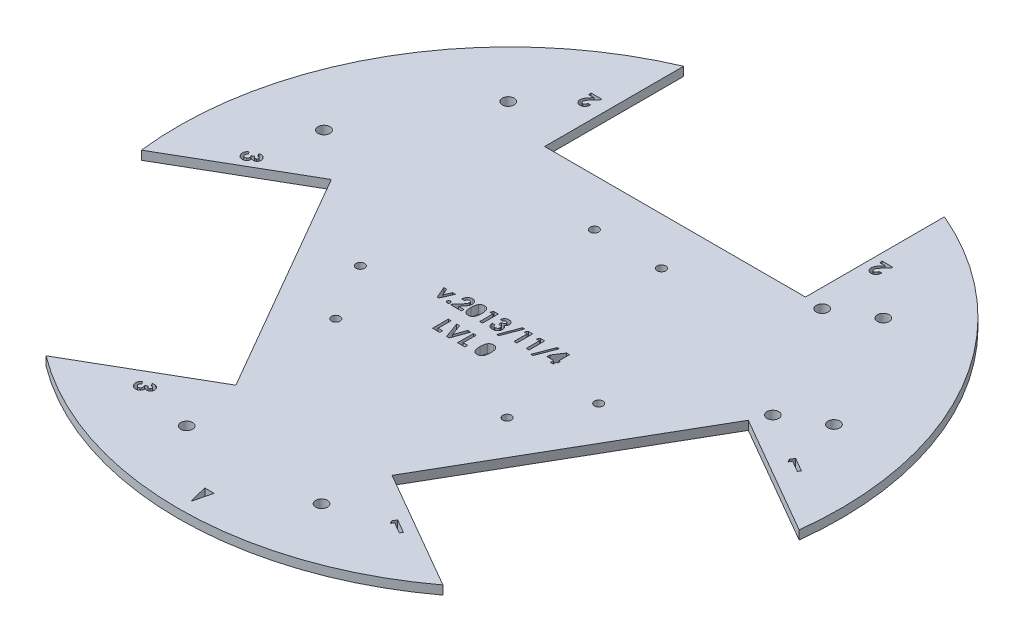
from build123d import *

# Parameters (mm, degrees)
ACRILIC_WHEELS_AND_MOTOR_MOUNTING_HOLES_DEPTH = 2.3622
STRUCTURE_MOUNTING_HOLES_DEPTH                = 2.3622
SKETCH4_R                                     = 1.15
SKETCH4_R_2                                   = 1.59
CUT_EXTRUDE1_DEPTH                            = 10


with BuildPart() as part:
    # Sketch1 → Acrilic, Wheels and Motor mounting holes (new body)
    with BuildSketch(Plane(origin=(0, 0, 0), x_dir=(1, 0, 0), z_dir=(0, 1, 0))):
        with BuildLine():
            Line((-35, 44.411902139), (-35, 81.720315712))
            ThreePointArc((-35, 81.720315712), (-76.989658396, 44.45), (-88.271869412, -10.549268723))
            Line((-88.271869412, -10.549268723), (-55.961835482, 8.104938063))
            Line((-55.961835482, 8.104938063), (-20.961835482, -52.516840202))
            Line((-20.961835482, -52.516840202), (-53.271869412, -71.171046988))
            ThreePointArc((-53.271869412, -71.171046988), (0, -88.9), (53.271869412, -71.171046988))
            Line((53.271869412, -71.171046988), (20.961835482, -52.516840202))
            Line((20.961835482, -52.516840202), (55.961835482, 8.104938063))
            Line((55.961835482, 8.104938063), (88.271869412, -10.549268723))
            ThreePointArc((88.271869412, -10.549268723), (76.989658396, 44.45), (35, 81.720315712))
            Line((35, 81.720315712), (35, 44.411902139))
            Line((35, 44.411902139), (-35, 44.411902139))
        make_face()
    extrude(amount=ACRILIC_WHEELS_AND_MOTOR_MOUNTING_HOLES_DEPTH)

    # Sketch3 → Structure Mounting Holes (cut)
    # profile 1 of 22: a face of its own
    with BuildSketch(Plane(origin=(0, 2.3622, 0), x_dir=(1, 0, 0), z_dir=(0, 1, 0))):
        Polygon((-1.25, -80.58), (0, -85.58), (1.25, -80.58), align=None)
    # profile 2 of 22: a face of its own
    with BuildSketch(Plane(origin=(0, 2.3622, 0), x_dir=(1, 0, 0), z_dir=(0, 1, 0))):
        with BuildLine():
            Line((-39.233333333, 60.243886703), (-38.473504273, 60.243886703))
            add(Edge.make_bspline(
                [(-38.473504273, 60.243886703), (-38.47678457, 60.186409053), (-38.483194073, 60.074101176), (-38.50871742, 59.910980475), (-38.542829951, 59.756811636), (-38.58874626, 59.612058152), (-38.645302495, 59.476659208), (-38.713906276, 59.351063304), (-38.792509338, 59.234370487), (-38.882696074, 59.128627316), (-38.980806241, 59.033560991), (-39.086588317, 58.950451513), (-39.199741814, 58.880878011), (-39.319510101, 58.823806551), (-39.445422742, 58.778142031), (-39.578751905, 58.747627678), (-39.718321136, 58.726958588), (-39.813868424, 58.725150252), (-39.862566773, 58.724228583)],
                knots=[0, 0, 0, 0, 1.198928049, 2.342633425, 3.435730849, 4.486331048, 5.502589352, 6.488331875, 7.46361919, 8.428949135, 9.378681775, 10.305958057, 11.226249248, 12.140413166, 13.066341608, 14.010670971, 14.986082777, 16, 16, 16, 16], degree=3))
            add(Edge.make_bspline(
                [(-39.862566773, 58.724228583), (-39.922368833, 58.725971441), (-40.039167765, 58.729375404), (-40.208343885, 58.762149283), (-40.367348991, 58.812633912), (-40.514611801, 58.885245216), (-40.649360484, 58.977226335), (-40.769993167, 59.088075412), (-40.877063493, 59.216432734), (-40.967041726, 59.361360135), (-41.04022663, 59.515358409), (-41.093067797, 59.673667626), (-41.127388997, 59.833095836), (-41.131074891, 59.940408563), (-41.132905983, 59.993719769)],
                knots=[0, 0, 0, 0, 1.075206757, 2.099977874, 3.089436832, 4.070080219, 5.043757236, 6.01602434, 7.009399377, 8.042659726, 9.078134622, 10.07077983, 11.041594984, 12, 12, 12, 12], degree=3))
            add(Edge.make_bspline(
                [(-41.132905983, 59.993719769), (-41.132195753, 60.025968023), (-41.130766235, 60.090875792), (-41.120826609, 60.189097176), (-41.105915208, 60.289147141), (-41.083432442, 60.390939897), (-41.055394616, 60.494504001), (-41.021380573, 60.600149295), (-40.980601839, 60.70727716), (-40.933736911, 60.817091918), (-40.877833688, 60.929955645), (-40.812714374, 61.047537313), (-40.736582123, 61.170160469), (-40.65018021, 61.297443343), (-40.554117271, 61.430373043), (-40.446931123, 61.567375224), (-40.329994564, 61.709996627), (-40.246974056, 61.805312489), (-40.204320246, 61.854283338)],
                knots=[0, 0, 0, 0, 0.728286467, 1.465860763, 2.227952348, 3.011875114, 3.818782069, 4.650637576, 5.517456182, 6.406927181, 7.346324104, 8.360844784, 9.441645378, 10.605053135, 11.834886952, 13.145197974, 14.533275831, 16, 16, 16, 16], degree=3))
            Line((-40.204320246, 61.854283338), (-39.7625, 62.36055337))
            Line((-39.7625, 62.36055337), (-41.187179487, 62.36055337))
            Line((-41.187179487, 62.36055337), (-41.187179487, 63.066108925))
            Line((-41.187179487, 63.066108925), (-38.364957265, 63.066108925))
            Line((-38.364957265, 63.066108925), (-38.364957265, 62.681106254))
            Line((-38.364957265, 62.681106254), (-39.618336004, 61.347165282))
            add(Edge.make_bspline(
                [(-39.618336004, 61.347165282), (-39.654625114, 61.308254197), (-39.724906359, 61.232894964), (-39.824899994, 61.12221559), (-39.915418702, 61.017206178), (-39.994438497, 60.916648965), (-40.066740303, 60.823948688), (-40.127226081, 60.735600922), (-40.179901784, 60.654093695), (-40.234927119, 60.554739629), (-40.288385689, 60.437137204), (-40.337406345, 60.301738125), (-40.366988295, 60.172237042), (-40.371102977, 60.087700276), (-40.373076923, 60.04714525)],
                knots=[0, 0, 0, 0, 1.246192343, 2.413505005, 3.49357156, 4.492416076, 5.408771964, 6.246246772, 6.999304986, 7.680960093, 8.904522682, 10.020616941, 11.0504258, 12, 12, 12, 12], degree=3))
            add(Edge.make_bspline(
                [(-40.373076923, 60.04714525), (-40.371627931, 60.007898316), (-40.368820277, 59.931851089), (-40.337197363, 59.823989032), (-40.289881669, 59.725589857), (-40.221188254, 59.641135917), (-40.138277057, 59.571131455), (-40.041920469, 59.519833031), (-39.933887672, 59.489682515), (-39.858235549, 59.485968339), (-39.819317575, 59.484057643)],
                knots=[0, 0, 0, 0, 1.061596218, 2.057012874, 3.024113775, 4.006148568, 4.986025304, 5.949989669, 6.945406325, 8, 8, 8, 8], degree=3))
            add(Edge.make_bspline(
                [(-39.819317575, 59.484057643), (-39.799216018, 59.484768625), (-39.759642877, 59.486168307), (-39.701473451, 59.495485614), (-39.646121064, 59.511906395), (-39.592969612, 59.533907929), (-39.542586341, 59.563071121), (-39.495098334, 59.599019401), (-39.450005245, 59.640839243), (-39.407513889, 59.68839988), (-39.368841207, 59.741477565), (-39.334492273, 59.799587542), (-39.306091423, 59.86269374), (-39.281086282, 59.929963061), (-39.261801121, 60.002118032), (-39.247759131, 60.078726814), (-39.237083944, 60.159664775), (-39.23460628, 60.215302012), (-39.233333333, 60.243886703)],
                knots=[0, 0, 0, 0, 0.903469896, 1.778625579, 2.63899355, 3.493148037, 4.358286772, 5.247621495, 6.164656832, 7.118446693, 8.109501108, 9.111810964, 10.146451449, 11.215617525, 12.33435995, 13.498009769, 14.714554818, 16, 16, 16, 16], degree=3))
        make_face()
    # profile 3 of 22: a face of its own
    with BuildSketch(Plane(origin=(0, 2.3622, 0), x_dir=(1, 0, 0), z_dir=(0, 1, 0))):
        with BuildLine():
            Line((38.907692308, 60.243886703), (39.667521368, 60.243886703))
            add(Edge.make_bspline(
                [(39.667521368, 60.243886703), (39.664241071, 60.186409053), (39.657831568, 60.074101176), (39.632308221, 59.910980475), (39.59819569, 59.756811636), (39.552279381, 59.612058152), (39.495723146, 59.476659208), (39.427119365, 59.351063304), (39.348516303, 59.234370487), (39.258329567, 59.128627316), (39.1602194, 59.033560991), (39.054437324, 58.950451513), (38.941283827, 58.880878011), (38.82151554, 58.823806551), (38.695602899, 58.778142031), (38.562273736, 58.747627678), (38.422704505, 58.726958588), (38.327157217, 58.725150252), (38.278458868, 58.724228583)],
                knots=[0, 0, 0, 0, 1.198928049, 2.342633425, 3.435730849, 4.486331048, 5.502589352, 6.488331875, 7.46361919, 8.428949135, 9.378681775, 10.305958057, 11.226249248, 12.140413166, 13.066341608, 14.010670971, 14.986082777, 16, 16, 16, 16], degree=3))
            add(Edge.make_bspline(
                [(38.278458868, 58.724228583), (38.218656808, 58.725971441), (38.101857876, 58.729375404), (37.932681756, 58.762149283), (37.77367665, 58.812633912), (37.62641384, 58.885245216), (37.491665157, 58.977226335), (37.371032474, 59.088075412), (37.263962148, 59.216432734), (37.173983915, 59.361360135), (37.100799011, 59.515358409), (37.047957844, 59.673667626), (37.013636644, 59.833095836), (37.00995075, 59.940408563), (37.008119658, 59.993719769)],
                knots=[0, 0, 0, 0, 1.075206757, 2.099977874, 3.089436832, 4.070080219, 5.043757236, 6.01602434, 7.009399377, 8.042659726, 9.078134622, 10.07077983, 11.041594984, 12, 12, 12, 12], degree=3))
            add(Edge.make_bspline(
                [(37.008119658, 59.993719769), (37.008829888, 60.025968023), (37.010259406, 60.090875792), (37.020199032, 60.189097176), (37.035110433, 60.289147141), (37.057593199, 60.390939897), (37.085631025, 60.494504001), (37.119645068, 60.600149295), (37.160423802, 60.70727716), (37.20728873, 60.817091918), (37.263191953, 60.929955645), (37.328311267, 61.047537313), (37.404443518, 61.170160469), (37.490845431, 61.297443343), (37.58690837, 61.430373043), (37.694094518, 61.567375224), (37.811031077, 61.709996627), (37.894051585, 61.805312489), (37.936705395, 61.854283338)],
                knots=[0, 0, 0, 0, 0.728286467, 1.465860763, 2.227952348, 3.011875114, 3.818782069, 4.650637576, 5.517456182, 6.406927181, 7.346324104, 8.360844784, 9.441645378, 10.605053135, 11.834886952, 13.145197974, 14.533275831, 16, 16, 16, 16], degree=3))
            Line((37.936705395, 61.854283338), (38.378525641, 62.36055337))
            Line((38.378525641, 62.36055337), (36.953846154, 62.36055337))
            Line((36.953846154, 62.36055337), (36.953846154, 63.066108925))
            Line((36.953846154, 63.066108925), (39.776068376, 63.066108925))
            Line((39.776068376, 63.066108925), (39.776068376, 62.681106254))
            Line((39.776068376, 62.681106254), (38.522689637, 61.347165282))
            add(Edge.make_bspline(
                [(38.522689637, 61.347165282), (38.486400527, 61.308254197), (38.416119282, 61.232894964), (38.316125647, 61.12221559), (38.225606939, 61.017206178), (38.146587144, 60.916648965), (38.074285338, 60.823948688), (38.01379956, 60.735600922), (37.961123857, 60.654093695), (37.906098522, 60.554739629), (37.852639952, 60.437137204), (37.803619296, 60.301738125), (37.774037346, 60.172237042), (37.769922664, 60.087700276), (37.767948718, 60.04714525)],
                knots=[0, 0, 0, 0, 1.246192343, 2.413505005, 3.49357156, 4.492416076, 5.408771964, 6.246246772, 6.999304986, 7.680960093, 8.904522682, 10.020616941, 11.0504258, 12, 12, 12, 12], degree=3))
            add(Edge.make_bspline(
                [(37.767948718, 60.04714525), (37.76939771, 60.007898316), (37.772205364, 59.931851089), (37.803828278, 59.823989032), (37.851143972, 59.725589857), (37.919837387, 59.641135917), (38.002748584, 59.571131455), (38.099105172, 59.519833031), (38.207137969, 59.489682515), (38.282790092, 59.485968339), (38.321708066, 59.484057643)],
                knots=[0, 0, 0, 0, 1.061596218, 2.057012874, 3.024113775, 4.006148568, 4.986025304, 5.949989669, 6.945406325, 8, 8, 8, 8], degree=3))
            add(Edge.make_bspline(
                [(38.321708066, 59.484057643), (38.341809623, 59.484768625), (38.381382764, 59.486168307), (38.43955219, 59.495485614), (38.494904577, 59.511906395), (38.548056029, 59.533907929), (38.5984393, 59.563071121), (38.645927307, 59.599019401), (38.691020396, 59.640839243), (38.733511752, 59.68839988), (38.772184434, 59.741477565), (38.806533368, 59.799587542), (38.834934218, 59.86269374), (38.859939359, 59.929963061), (38.87922452, 60.002118032), (38.89326651, 60.078726814), (38.903941697, 60.159664775), (38.906419361, 60.215302012), (38.907692308, 60.243886703)],
                knots=[0, 0, 0, 0, 0.903469896, 1.778625579, 2.63899355, 3.493148037, 4.358286772, 5.247621495, 6.164656832, 7.118446693, 8.109501108, 9.111810964, 10.146451449, 11.215617525, 12.33435995, 13.498009769, 14.714554818, 16, 16, 16, 16], degree=3))
        make_face()
    # profile 4 of 22: a face of its own
    with BuildSketch(Plane(origin=(0, 2.3622, 0), x_dir=(1, 0, 0), z_dir=(0, 1, 0))):
        Polygon((31.468167885, -63.164936903), (32.071112597, -62.12101997), (35.735422159, -64.237686636), (35.335155065, -64.930521839), (32.325519648, -63.192073655), (31.889635567, -63.946814574), align=None)
    # profile 5 of 22: a face of its own
    with BuildSketch(Plane(origin=(0, 2.3622, 0), x_dir=(1, 0, 0), z_dir=(0, 1, 0))):
        Polygon((70.565817458, 4.554178613), (71.168762169, 5.598095547), (74.833071731, 3.48142888), (74.432804637, 2.788593677), (71.42316922, 4.527041861), (70.987285139, 3.772300942), align=None)
    # profile 6 of 22: a face of its own
    with BuildSketch(Plane(origin=(0, 2.3622, 0), x_dir=(1, 0, 0), z_dir=(0, 1, 0))):
        with BuildLine():
            Line((-32.1686353, -64.03908428), (-32.555334018, -63.369145711))
            add(Edge.make_bspline(
                [(-32.555334018, -63.369145711), (-32.519349791, -63.354744639), (-32.449064262, -63.32661601), (-32.342059138, -63.294414833), (-32.236939218, -63.270472912), (-32.133180586, -63.255162711), (-32.031064306, -63.247885016), (-31.930648622, -63.250884171), (-31.831672218, -63.261091233), (-31.767400057, -63.276032155), (-31.735295289, -63.283495337)],
                knots=[0, 0, 0, 0, 1.107901622, 2.163988478, 3.191569978, 4.188424195, 5.1605888, 6.114741573, 7.058289259, 8, 8, 8, 8], degree=3))
            add(Edge.make_bspline(
                [(-31.735295289, -63.283495337), (-31.691480086, -63.295922055), (-31.604962357, -63.320459916), (-31.481240193, -63.371888016), (-31.365524897, -63.435033887), (-31.256964654, -63.508801334), (-31.157255825, -63.595688225), (-31.064432757, -63.693228055), (-30.98018141, -63.803452802), (-30.930978698, -63.883167985), (-30.905928302, -63.923753083)],
                knots=[0, 0, 0, 0, 1.013465039, 2.001193364, 2.975737525, 3.944696158, 4.917572099, 5.914900419, 6.938420904, 8, 8, 8, 8], degree=3))
            add(Edge.make_bspline(
                [(-30.905928302, -63.923753083), (-30.885408607, -63.960988428), (-30.845060806, -64.034204154), (-30.797938497, -64.148704995), (-30.760842378, -64.263398179), (-30.736149482, -64.379060388), (-30.723527286, -64.495260794), (-30.721574804, -64.611995173), (-30.731970249, -64.729607688), (-30.753928306, -64.846239078), (-30.786124598, -64.959347305), (-30.826448387, -65.066293039), (-30.875819282, -65.165703068), (-30.934956506, -65.257057201), (-31.002565592, -65.341278548), (-31.080054583, -65.416914126), (-31.164587562, -65.486841075), (-31.227650378, -65.525014111), (-31.259554103, -65.544326)],
                knots=[0, 0, 0, 0, 1.105385769, 2.173516099, 3.215551147, 4.238278602, 5.244584198, 6.252286397, 7.271065952, 8.311100557, 9.335492682, 10.327151563, 11.28099778, 12.21738801, 13.153518256, 14.084433573, 15.030907478, 16, 16, 16, 16], degree=3))
            add(Edge.make_bspline(
                [(-31.259554103, -65.544326), (-31.300552817, -65.565663943), (-31.381344077, -65.607712076), (-31.511712513, -65.648467404), (-31.645970864, -65.669832183), (-31.783948522, -65.671396194), (-31.923812576, -65.652851555), (-32.062622829, -65.611761746), (-32.201359275, -65.552258012), (-32.288311145, -65.497789246), (-32.333151859, -65.469699931)],
                knots=[0, 0, 0, 0, 0.974404531, 1.920142448, 2.86905825, 3.836085688, 4.823745563, 5.836306088, 6.884192119, 8, 8, 8, 8], degree=3))
            add(Edge.make_bspline(
                [(-32.333151859, -65.469699931), (-32.326225176, -65.501843633), (-32.31256818, -65.565219758), (-32.299690467, -65.660446115), (-32.294921003, -65.753712702), (-32.295825565, -65.845394987), (-32.306865139, -65.934844046), (-32.322403259, -66.022944198), (-32.346466663, -66.108884106), (-32.377627287, -66.192612325), (-32.416135782, -66.27273239), (-32.45895856, -66.350186056), (-32.510511004, -66.42163288), (-32.566411694, -66.490353621), (-32.62926187, -66.553508831), (-32.69801944, -66.612925776), (-32.77309522, -66.667657202), (-32.826750993, -66.700541414), (-32.853838291, -66.717142506)],
                knots=[0, 0, 0, 0, 1.082911052, 2.135121458, 3.160919659, 4.157434519, 5.150768472, 6.126044305, 7.10198669, 8.086112758, 9.064938288, 10.028182329, 10.996991188, 11.962707453, 12.943789211, 13.927518729, 14.953739469, 16, 16, 16, 16], degree=3))
            add(Edge.make_bspline(
                [(-32.853838291, -66.717142506), (-32.894974229, -66.739481944), (-32.975715496, -66.7833296), (-33.102565952, -66.833665007), (-33.231140317, -66.869368), (-33.361847124, -66.891513277), (-33.494333094, -66.900533355), (-33.628760897, -66.892941048), (-33.76474066, -66.872468224), (-33.901400688, -66.838734888), (-34.035388499, -66.791811085), (-34.163531425, -66.731169949), (-34.284233856, -66.657686671), (-34.398649536, -66.572822506), (-34.504727655, -66.474334945), (-34.60447083, -66.364608665), (-34.696602107, -66.24182804), (-34.750487319, -66.152849964), (-34.778003622, -66.107413606)],
                knots=[0, 0, 0, 0, 0.995956168, 1.954854222, 2.898137721, 3.832159877, 4.772963349, 5.719084143, 6.69280729, 7.697075385, 8.711624244, 9.71041314, 10.7095465, 11.715832357, 12.738081516, 13.786223357, 14.869542352, 16, 16, 16, 16], degree=3))
            add(Edge.make_bspline(
                [(-34.778003622, -66.107413606), (-34.802320478, -66.063454261), (-34.849831074, -65.977565912), (-34.905393857, -65.843956757), (-34.949796638, -65.711600796), (-34.978124472, -65.578409268), (-34.995177932, -65.445891693), (-34.996110691, -65.313446261), (-34.985805705, -65.181477993), (-34.959601928, -65.050978928), (-34.922123144, -64.922762146), (-34.86979015, -64.799765027), (-34.805769162, -64.681318868), (-34.728234768, -64.568946143), (-34.638920633, -64.460948232), (-34.534967047, -64.360656941), (-34.420842928, -64.262622671), (-34.336223262, -64.20506234), (-34.292934178, -64.175616064)],
                knots=[0, 0, 0, 0, 1.0828852, 2.115755418, 3.116538504, 4.090108764, 5.048377776, 5.993598408, 6.942058762, 7.898755042, 8.859523462, 9.818742628, 10.776468272, 11.759123839, 12.759237952, 13.794086196, 14.871515413, 16, 16, 16, 16], degree=3))
            Line((-34.292934178, -64.175616064), (-33.893515107, -64.865907196))
            add(Edge.make_bspline(
                [(-33.893515107, -64.865907196), (-33.914080491, -64.883192315), (-33.954238338, -64.916944816), (-34.009386918, -64.970313477), (-34.058043155, -65.024597479), (-34.099778339, -65.080084583), (-34.135435342, -65.135817595), (-34.165058435, -65.19234616), (-34.186633376, -65.250075185), (-34.208667272, -65.326585096), (-34.218335084, -65.424681658), (-34.209229419, -65.543219335), (-34.175469807, -65.662197858), (-34.136604918, -65.736591196), (-34.116545289, -65.774988393)],
                knots=[0, 0, 0, 0, 0.934463678, 1.824719104, 2.667592896, 3.468150092, 4.237532693, 4.967698102, 5.683684191, 6.378067433, 7.733490483, 9.085197688, 10.495561016, 12, 12, 12, 12], degree=3))
            add(Edge.make_bspline(
                [(-34.116545289, -65.774988393), (-34.104418137, -65.794694996), (-34.080761656, -65.833136741), (-34.040538655, -65.886570096), (-33.996189627, -65.933627197), (-33.949679044, -65.977031553), (-33.898311147, -66.012901854), (-33.844676461, -66.04525658), (-33.786761144, -66.070040807), (-33.707162792, -66.097431971), (-33.604671874, -66.115450212), (-33.481575386, -66.113339819), (-33.360557483, -66.085222731), (-33.286786966, -66.047177931), (-33.249017244, -66.027699397)],
                knots=[0, 0, 0, 0, 0.825498595, 1.61030317, 2.381175776, 3.130970414, 3.875590236, 4.612586818, 5.362313599, 6.118325097, 7.614245731, 9.046966094, 10.488077951, 12, 12, 12, 12], degree=3))
            add(Edge.make_bspline(
                [(-33.249017244, -66.027699397), (-33.228868996, -66.015501096), (-33.189128614, -65.991441182), (-33.136449253, -65.946730315), (-33.090133943, -65.896676033), (-33.049035579, -65.842036502), (-33.016351949, -65.780597986), (-32.987852536, -65.715378641), (-32.966680523, -65.644189597), (-32.952647836, -65.568002844), (-32.944746544, -65.487421147), (-32.945594379, -65.403244353), (-32.956249312, -65.31640878), (-32.975174058, -65.226816466), (-33.002673505, -65.134214438), (-33.038215274, -65.038262267), (-33.083627692, -64.939672179), (-33.118903827, -64.874198582), (-33.137078141, -64.840466491)],
                knots=[0, 0, 0, 0, 0.848676311, 1.673928198, 2.482115482, 3.306169204, 4.132302839, 4.986658837, 5.870690431, 6.804777346, 7.777963707, 8.78765716, 9.835068452, 10.929153256, 12.087693689, 13.317140735, 14.61778708, 16, 16, 16, 16], degree=3))
            Line((-33.137078141, -64.840466491), (-32.539221571, -64.495320925))
            add(Edge.make_bspline(
                [(-32.539221571, -64.495320925), (-32.51326316, -64.53281922), (-32.464671135, -64.603012967), (-32.387583301, -64.694442034), (-32.317441062, -64.769657034), (-32.24860183, -64.825537635), (-32.181437505, -64.867400041), (-32.113048676, -64.895268647), (-32.044422462, -64.917326823), (-31.974129222, -64.925711758), (-31.905151984, -64.926137617), (-31.838475458, -64.916831134), (-31.775490767, -64.897467333), (-31.736737, -64.877514458), (-31.717486795, -64.867603243)],
                knots=[0, 0, 0, 0, 1.636125233, 3.062692806, 4.28985753, 5.321554568, 6.236960596, 7.119026226, 7.96656224, 8.816161126, 9.648248204, 10.437530957, 11.223872881, 12, 12, 12, 12], degree=3))
            add(Edge.make_bspline(
                [(-31.717486795, -64.867603243), (-31.694218019, -64.85234242), (-31.649000859, -64.822686754), (-31.592999176, -64.764455996), (-31.552875795, -64.695913049), (-31.526516338, -64.619915549), (-31.514947878, -64.538483038), (-31.522889094, -64.454709434), (-31.545542882, -64.369670684), (-31.573865735, -64.316755276), (-31.588587223, -64.289251213)],
                knots=[0, 0, 0, 0, 1.003706715, 1.950457832, 2.889735573, 3.852723985, 4.842604589, 5.837115255, 6.875788371, 8, 8, 8, 8], degree=3))
            add(Edge.make_bspline(
                [(-31.588587223, -64.289251213), (-31.603853194, -64.265130206), (-31.63391563, -64.217630035), (-31.693511432, -64.158149071), (-31.760003001, -64.106572691), (-31.836537691, -64.068854197), (-31.917020326, -64.040315226), (-32.000368873, -64.026228959), (-32.084991992, -64.02333341), (-32.140466494, -64.033779812), (-32.1686353, -64.03908428)],
                knots=[0, 0, 0, 0, 1.011574127, 1.992037248, 2.974608507, 3.990066615, 5.009938377, 5.999317311, 6.984094696, 8, 8, 8, 8], degree=3))
        make_face()
    # profile 7 of 22: a face of its own
    with BuildSketch(Plane(origin=(0, 2.3622, 0), x_dir=(1, 0, 0), z_dir=(0, 1, 0))):
        with BuildLine():
            Line((-71.266284872, 3.680031237), (-71.65298359, 4.349969805))
            add(Edge.make_bspline(
                [(-71.65298359, 4.349969805), (-71.616999364, 4.364370877), (-71.546713835, 4.392499506), (-71.439708711, 4.424700683), (-71.33458879, 4.448642604), (-71.230830159, 4.463952805), (-71.128713879, 4.471230501), (-71.028298195, 4.468231346), (-70.92932179, 4.458024284), (-70.865049629, 4.443083361), (-70.832944862, 4.435620179)],
                knots=[0, 0, 0, 0, 1.107901622, 2.163988478, 3.191569978, 4.188424195, 5.1605888, 6.114741573, 7.058289259, 8, 8, 8, 8], degree=3))
            add(Edge.make_bspline(
                [(-70.832944862, 4.435620179), (-70.789129659, 4.423193462), (-70.70261193, 4.3986556), (-70.578889766, 4.3472275), (-70.46317447, 4.284081629), (-70.354614227, 4.210314182), (-70.254905398, 4.123427291), (-70.16208233, 4.025887462), (-70.077830982, 3.915662715), (-70.02862827, 3.835947532), (-70.003577874, 3.795362433)],
                knots=[0, 0, 0, 0, 1.013465039, 2.001193364, 2.975737525, 3.944696158, 4.917572099, 5.914900419, 6.938420904, 8, 8, 8, 8], degree=3))
            add(Edge.make_bspline(
                [(-70.003577874, 3.795362433), (-69.98305818, 3.758127088), (-69.942710378, 3.684911362), (-69.895588069, 3.570410521), (-69.858491951, 3.455717337), (-69.833799054, 3.340055129), (-69.821176858, 3.223854723), (-69.819224377, 3.107120344), (-69.829619821, 2.989507828), (-69.851577879, 2.872876438), (-69.883774171, 2.759768211), (-69.92409796, 2.652822477), (-69.973468855, 2.553412449), (-70.032606079, 2.462058315), (-70.100215164, 2.377836969), (-70.177704155, 2.30220139), (-70.262237134, 2.232274442), (-70.325299951, 2.194101405), (-70.357203676, 2.174789517)],
                knots=[0, 0, 0, 0, 1.105385769, 2.173516099, 3.215551147, 4.238278602, 5.244584198, 6.252286397, 7.271065952, 8.311100557, 9.335492682, 10.327151563, 11.28099778, 12.21738801, 13.153518256, 14.084433573, 15.030907478, 16, 16, 16, 16], degree=3))
            add(Edge.make_bspline(
                [(-70.357203676, 2.174789517), (-70.398202389, 2.153451573), (-70.47899365, 2.111403441), (-70.609362085, 2.070648112), (-70.743620437, 2.049283333), (-70.881598095, 2.047719322), (-71.021462148, 2.066263961), (-71.160272402, 2.10735377), (-71.299008848, 2.166857504), (-71.385960717, 2.221326271), (-71.430801432, 2.249415585)],
                knots=[0, 0, 0, 0, 0.974404531, 1.920142448, 2.86905825, 3.836085688, 4.823745563, 5.836306088, 6.884192119, 8, 8, 8, 8], degree=3))
            add(Edge.make_bspline(
                [(-71.430801432, 2.249415585), (-71.423874748, 2.217271884), (-71.410217753, 2.153895758), (-71.397340039, 2.058669401), (-71.392570576, 1.965402814), (-71.393475137, 1.873720529), (-71.404514712, 1.784271471), (-71.420052831, 1.696171318), (-71.444116236, 1.61023141), (-71.475276859, 1.526503191), (-71.513785355, 1.446383126), (-71.556608132, 1.36892946), (-71.608160577, 1.297482637), (-71.664061267, 1.228761895), (-71.726911443, 1.165606685), (-71.795669012, 1.10618974), (-71.870744792, 1.051458315), (-71.924400566, 1.018574103), (-71.951487864, 1.00197301)],
                knots=[0, 0, 0, 0, 1.082911052, 2.135121458, 3.160919659, 4.157434519, 5.150768472, 6.126044305, 7.10198669, 8.086112758, 9.064938288, 10.028182329, 10.996991188, 11.962707453, 12.943789211, 13.927518729, 14.953739469, 16, 16, 16, 16], degree=3))
            add(Edge.make_bspline(
                [(-71.951487864, 1.00197301), (-71.992623802, 0.979633573), (-72.073365069, 0.935785916), (-72.200215525, 0.88545051), (-72.32878989, 0.849747517), (-72.459496697, 0.827602239), (-72.591982667, 0.818582161), (-72.72641047, 0.826174468), (-72.862390233, 0.846647293), (-72.999050261, 0.880380628), (-73.133038071, 0.927304431), (-73.261180998, 0.987945568), (-73.381883429, 1.061428846), (-73.496299109, 1.146293011), (-73.602377228, 1.244780572), (-73.702120402, 1.354506852), (-73.79425168, 1.477287476), (-73.848136891, 1.566265552), (-73.875653195, 1.61170191)],
                knots=[0, 0, 0, 0, 0.995956168, 1.954854222, 2.898137721, 3.832159877, 4.772963349, 5.719084143, 6.69280729, 7.697075385, 8.711624244, 9.71041314, 10.7095465, 11.715832357, 12.738081516, 13.786223357, 14.869542352, 16, 16, 16, 16], degree=3))
            add(Edge.make_bspline(
                [(-73.875653195, 1.61170191), (-73.899970051, 1.655661255), (-73.947480646, 1.741549605), (-74.00304343, 1.875158759), (-74.04744621, 2.007514721), (-74.075774044, 2.140706248), (-74.092827505, 2.273223823), (-74.093760263, 2.405669256), (-74.083455277, 2.537637523), (-74.057251501, 2.668136589), (-74.019772717, 2.79635337), (-73.967439723, 2.91935049), (-73.903418734, 3.037796648), (-73.82588434, 3.150169373), (-73.736570206, 3.258167284), (-73.63261662, 3.358458576), (-73.518492501, 3.456492846), (-73.433872835, 3.514053177), (-73.39058375, 3.543499453)],
                knots=[0, 0, 0, 0, 1.0828852, 2.115755418, 3.116538504, 4.090108764, 5.048377776, 5.993598408, 6.942058762, 7.898755042, 8.859523462, 9.818742628, 10.776468272, 11.759123839, 12.759237952, 13.794086196, 14.871515413, 16, 16, 16, 16], degree=3))
            Line((-73.39058375, 3.543499453), (-72.99116468, 2.85320832))
            add(Edge.make_bspline(
                [(-72.99116468, 2.85320832), (-73.011730064, 2.835923201), (-73.05188791, 2.8021707), (-73.107036491, 2.74880204), (-73.155692728, 2.694518037), (-73.197427912, 2.639030934), (-73.233084914, 2.583297921), (-73.262708008, 2.526769356), (-73.284282948, 2.469040332), (-73.306316845, 2.39253042), (-73.315984656, 2.294433858), (-73.306878991, 2.175896181), (-73.273119379, 2.056917659), (-73.234254491, 1.98252432), (-73.214194862, 1.944127124)],
                knots=[0, 0, 0, 0, 0.934463678, 1.824719104, 2.667592896, 3.468150092, 4.237532693, 4.967698102, 5.683684191, 6.378067433, 7.733490483, 9.085197688, 10.495561016, 12, 12, 12, 12], degree=3))
            add(Edge.make_bspline(
                [(-73.214194862, 1.944127124), (-73.202067709, 1.92442052), (-73.178411229, 1.885978776), (-73.138188228, 1.83254542), (-73.093839199, 1.785488319), (-73.047328616, 1.742083963), (-72.995960719, 1.706213662), (-72.942326033, 1.673858936), (-72.884410717, 1.649074709), (-72.804812365, 1.621683545), (-72.702321446, 1.603665305), (-72.579224959, 1.605775697), (-72.458207056, 1.633892786), (-72.384436539, 1.671937585), (-72.346666817, 1.691416119)],
                knots=[0, 0, 0, 0, 0.825498595, 1.61030317, 2.381175776, 3.130970414, 3.875590236, 4.612586818, 5.362313599, 6.118325097, 7.614245731, 9.046966094, 10.488077951, 12, 12, 12, 12], degree=3))
            add(Edge.make_bspline(
                [(-72.346666817, 1.691416119), (-72.326518568, 1.70361442), (-72.286778186, 1.727674334), (-72.234098826, 1.772385201), (-72.187783516, 1.822439483), (-72.146685151, 1.877079014), (-72.114001522, 1.93851753), (-72.085502109, 2.003736875), (-72.064330095, 2.074925919), (-72.050297408, 2.151112672), (-72.042396116, 2.231694369), (-72.043243952, 2.315871164), (-72.053898884, 2.402706736), (-72.072823631, 2.49229905), (-72.100323077, 2.584901078), (-72.135864847, 2.680853249), (-72.181277265, 2.779443337), (-72.216553399, 2.844916935), (-72.234727714, 2.878649025)],
                knots=[0, 0, 0, 0, 0.848676311, 1.673928198, 2.482115482, 3.306169204, 4.132302839, 4.986658837, 5.870690431, 6.804777346, 7.777963707, 8.78765716, 9.835068452, 10.929153256, 12.087693689, 13.317140735, 14.61778708, 16, 16, 16, 16], degree=3))
            Line((-72.234727714, 2.878649025), (-71.636871144, 3.223794591))
            add(Edge.make_bspline(
                [(-71.636871144, 3.223794591), (-71.610912733, 3.186296296), (-71.562320708, 3.11610255), (-71.485232874, 3.024673482), (-71.415090635, 2.949458482), (-71.346251403, 2.893577881), (-71.279087078, 2.851715476), (-71.210698249, 2.82384687), (-71.142072034, 2.801788693), (-71.071778795, 2.793403758), (-71.002801557, 2.7929779), (-70.936125031, 2.802284383), (-70.873140339, 2.821648183), (-70.834386573, 2.841601058), (-70.815136368, 2.851512273)],
                knots=[0, 0, 0, 0, 1.636125233, 3.062692806, 4.28985753, 5.321554568, 6.236960596, 7.119026226, 7.96656224, 8.816161126, 9.648248204, 10.437530957, 11.223872881, 12, 12, 12, 12], degree=3))
            add(Edge.make_bspline(
                [(-70.815136368, 2.851512273), (-70.791867592, 2.866773096), (-70.746650432, 2.896428762), (-70.690648748, 2.954659521), (-70.650525368, 3.023202468), (-70.624165911, 3.099199967), (-70.612597451, 3.180632478), (-70.620538667, 3.264406082), (-70.643192455, 3.349444832), (-70.671515308, 3.402360241), (-70.686236795, 3.429864303)],
                knots=[0, 0, 0, 0, 1.003706715, 1.950457832, 2.889735573, 3.852723985, 4.842604589, 5.837115255, 6.875788371, 8, 8, 8, 8], degree=3))
            add(Edge.make_bspline(
                [(-70.686236795, 3.429864303), (-70.701502766, 3.45398531), (-70.731565202, 3.501485481), (-70.791161005, 3.560966445), (-70.857652573, 3.612542825), (-70.934187264, 3.650261319), (-71.014669899, 3.67880029), (-71.098018446, 3.692886558), (-71.182641564, 3.695782106), (-71.238116067, 3.685335704), (-71.266284872, 3.680031237)],
                knots=[0, 0, 0, 0, 1.011574127, 1.992037248, 2.974608507, 3.990066615, 5.009938377, 5.999317311, 6.984094696, 8, 8, 8, 8], degree=3))
        make_face()
    # profile 8 of 22: a face of its own
    with BuildSketch(Plane(origin=(0, 2.3622, 0), x_dir=(1, 0, 0), z_dir=(0, 1, 0))):
        Polygon((15.931445576, -0.658119658), (16.723499529, -0.658119658), (16.723499529, -3.426068376), (17.103414059, -3.426068376), (17.103414059, -4.131623932), (16.723499529, -4.131623932), (16.723499529, -5), (15.963670469, -5), (15.963670469, -4.131623932), (14.172644828, -4.131623932), (14.172644828, -3.362466613), align=None)
        Polygon((15.963670469, -3.426068376), (15.963670469, -1.985276442), (15.026604497, -3.426068376), align=None, mode=Mode.SUBTRACT)
    # profile 9 of 22: a face of its own
    with BuildSketch(Plane(origin=(0, 2.3622, 0), x_dir=(1, 0, 0), z_dir=(0, 1, 0))):
        Polygon((11.458969614, -5.75982906), (13.406879603, -0.658119658), (13.982687563, -0.658119658), (12.034777574, -5.75982906), align=None)
    # profile 10 of 22: a face of its own
    with BuildSketch(Plane(origin=(0, 2.3622, 0), x_dir=(1, 0, 0), z_dir=(0, 1, 0))):
        Polygon((9.036166462, -0.766666667), (10.210679016, -0.766666667), (10.210679016, -5), (9.450849956, -5), (9.450849956, -1.472222222), (8.582473888, -1.472222222), align=None)
    # profile 11 of 22: a face of its own
    with BuildSketch(Plane(origin=(0, 2.3622, 0), x_dir=(1, 0, 0), z_dir=(0, 1, 0))):
        Polygon((5.779756206, -0.766666667), (6.954268759, -0.766666667), (6.954268759, -5), (6.1944397, -5), (6.1944397, -1.472222222), (5.326063631, -1.472222222), align=None)
    # profile 12 of 22: a face of its own
    with BuildSketch(Plane(origin=(0, 2.3622, 0), x_dir=(1, 0, 0), z_dir=(0, 1, 0))):
        Polygon((2.232473888, -5.75982906), (4.180383877, -0.658119658), (4.756191836, -0.658119658), (2.808281847, -5.75982906), align=None)
    # profile 13 of 22: a face of its own
    with BuildSketch(Plane(origin=(0, 2.3622, 0), x_dir=(1, 0, 0), z_dir=(0, 1, 0))):
        with BuildLine():
            Line((0.007260212, -1.797863248), (-0.752568847, -1.797863248))
            add(Edge.make_bspline(
                [(-0.752568847, -1.797863248), (-0.747204165, -1.759882104), (-0.736687061, -1.685422587), (-0.711521038, -1.577623755), (-0.681419759, -1.475369186), (-0.643839849, -1.378982698), (-0.599764729, -1.288292596), (-0.549642593, -1.202987675), (-0.492931602, -1.12343408), (-0.449462027, -1.075510678), (-0.427775845, -1.051602564)],
                knots=[0, 0, 0, 0, 1.111473889, 2.178970933, 3.205615836, 4.199322666, 5.174200091, 6.12565194, 7.064921805, 8, 8, 8, 8], degree=3))
            add(Edge.make_bspline(
                [(-0.427775845, -1.051602564), (-0.396496402, -1.02005754), (-0.334847907, -0.957885612), (-0.231826042, -0.878250239), (-0.123840101, -0.80933124), (-0.008724379, -0.75469176), (0.111729836, -0.71046743), (0.238480437, -0.680761848), (0.371009477, -0.661051932), (0.461443875, -0.659110436), (0.50759408, -0.658119658)],
                knots=[0, 0, 0, 0, 1.01925491, 2.00884431, 2.983262333, 3.955970413, 4.92937149, 5.924503185, 6.940838805, 8, 8, 8, 8], degree=3))
            add(Edge.make_bspline(
                [(0.50759408, -0.658119658), (0.548623987, -0.659088294), (0.629280517, -0.660992436), (0.747825321, -0.67627786), (0.860847871, -0.703086791), (0.969542848, -0.738138867), (1.072311704, -0.785833074), (1.171422647, -0.841195897), (1.264106513, -0.9091007), (1.350580165, -0.985826293), (1.430022707, -1.068812534), (1.498820296, -1.157518), (1.557966818, -1.249573165), (1.606695729, -1.345742833), (1.64416164, -1.446189734), (1.670164093, -1.5503336), (1.68718333, -1.65794463), (1.688878891, -1.731086398), (1.689738845, -1.768182425)],
                knots=[0, 0, 0, 0, 1.091422571, 2.145516843, 3.172569842, 4.178562979, 5.178154469, 6.181868002, 7.194278174, 8.227918432, 9.254613415, 10.245994977, 11.209837596, 12.161663635, 13.10878368, 14.055455738, 15.013766427, 16, 16, 16, 16], degree=3))
            add(Edge.make_bspline(
                [(1.689738845, -1.768182425), (1.687974168, -1.814122766), (1.684500061, -1.904565173), (1.655992497, -2.036934354), (1.611370408, -2.163502915), (1.546909461, -2.282499968), (1.466316859, -2.393601673), (1.367432435, -2.493093564), (1.253072675, -2.58253554), (1.16722128, -2.63060167), (1.123259144, -2.655215011)],
                knots=[0, 0, 0, 0, 0.992805628, 1.954529043, 2.915727527, 3.886831945, 4.871318353, 5.87440735, 6.911542536, 8, 8, 8, 8], degree=3))
            add(Edge.make_bspline(
                [(1.123259144, -2.655215011), (1.153434079, -2.665122077), (1.212726474, -2.684589019), (1.297003484, -2.72292894), (1.37714129, -2.764828119), (1.451759948, -2.81350392), (1.521601631, -2.866988109), (1.586240576, -2.925737888), (1.646062986, -2.989625156), (1.700092283, -3.059001269), (1.748045395, -3.13275669), (1.79107117, -3.209187713), (1.82648378, -3.289453428), (1.85648267, -3.372637147), (1.879322117, -3.459486481), (1.895403129, -3.549664895), (1.904698348, -3.642966688), (1.906116027, -3.706178597), (1.906832862, -3.738141026)],
                knots=[0, 0, 0, 0, 1.059543567, 2.081955587, 3.086750234, 4.076226789, 5.052108497, 6.020845489, 6.989030705, 7.970690546, 8.952259656, 9.923888338, 10.895517021, 11.877585046, 12.873342345, 13.889638361, 14.932918083, 16, 16, 16, 16], degree=3))
            add(Edge.make_bspline(
                [(1.906832862, -3.738141026), (1.905379742, -3.785112819), (1.902514485, -3.87773163), (1.884298525, -4.014149659), (1.850383689, -4.144212131), (1.805766843, -4.269415608), (1.746252814, -4.388143761), (1.676214806, -4.503121238), (1.590124022, -4.610360652), (1.494448899, -4.712697136), (1.388196096, -4.805736884), (1.273000773, -4.886398159), (1.151395975, -4.955619885), (1.022612343, -5.011816054), (0.88669462, -5.055093531), (0.743945754, -5.086376486), (0.593765954, -5.105515916), (0.49125649, -5.107522323), (0.438904176, -5.108547009)],
                knots=[0, 0, 0, 0, 1.005138573, 1.981928558, 2.936866704, 3.876260664, 4.820238198, 5.773547, 6.751179199, 7.756627054, 8.768222608, 9.766606018, 10.760583154, 11.757261445, 12.767156078, 13.807575856, 14.880313354, 16, 16, 16, 16], degree=3))
            add(Edge.make_bspline(
                [(0.438904176, -5.108547009), (0.389379731, -5.10746665), (0.292541233, -5.105354153), (0.150894662, -5.087069417), (0.016273004, -5.057574655), (-0.111667298, -5.015999341), (-0.232431253, -4.962083264), (-0.347113995, -4.897881314), (-0.453427055, -4.819690472), (-0.552554971, -4.73104042), (-0.642298786, -4.631580095), (-0.722508622, -4.523613446), (-0.791415839, -4.406729921), (-0.849303026, -4.281428894), (-0.895717636, -4.147490549), (-0.932329344, -4.005187258), (-0.957903221, -3.854241003), (-0.965691799, -3.750386769), (-0.969662864, -3.697435897)],
                knots=[0, 0, 0, 0, 1.066544725, 2.085487077, 3.070979577, 4.031932826, 4.977951092, 5.916076795, 6.857635327, 7.814973522, 8.776389752, 9.738577119, 10.707772778, 11.69409279, 12.707140348, 13.757286496, 14.856535458, 16, 16, 16, 16], degree=3))
            Line((-0.969662864, -3.697435897), (-0.209833805, -3.697435897))
            add(Edge.make_bspline(
                [(-0.209833805, -3.697435897), (-0.205018847, -3.724060291), (-0.195640455, -3.775918279), (-0.177348475, -3.850997117), (-0.153511474, -3.920299523), (-0.12594997, -3.984441452), (-0.096179397, -4.044265067), (-0.060209425, -4.097560934), (-0.020675745, -4.145776255), (0.036371644, -4.203095158), (0.117924815, -4.261987939), (0.228048613, -4.313168568), (0.350550911, -4.343166704), (0.436192234, -4.346826384), (0.480457328, -4.348717949)],
                knots=[0, 0, 0, 0, 0.928156231, 1.807827665, 2.648129825, 3.438902246, 4.202261636, 4.936546065, 5.639352463, 6.338805438, 7.70633318, 9.064371875, 10.482673459, 12, 12, 12, 12], degree=3))
            add(Edge.make_bspline(
                [(0.480457328, -4.348717949), (0.503945951, -4.348315158), (0.549954909, -4.347526181), (0.617535217, -4.338781425), (0.681914976, -4.324378805), (0.743214097, -4.304806179), (0.801822813, -4.280270668), (0.856621346, -4.248633596), (0.908726627, -4.211850982), (0.957572225, -4.17049756), (1.002706564, -4.125437133), (1.040260988, -4.075540366), (1.074583014, -4.024836332), (1.099967832, -3.970007796), (1.122210402, -3.914005117), (1.13582399, -3.854795575), (1.146103227, -3.793621226), (1.146700615, -3.751756187), (1.147003802, -3.730508814)],
                knots=[0, 0, 0, 0, 1.110435564, 2.175094844, 3.216326037, 4.226890168, 5.215276772, 6.21526065, 7.213097102, 8.228249917, 9.239874822, 10.221364777, 11.178138315, 12.128914389, 13.072518965, 14.022636769, 14.996447288, 16, 16, 16, 16], degree=3))
            add(Edge.make_bspline(
                [(1.147003802, -3.730508814), (1.146198898, -3.707271192), (1.144596518, -3.661010411), (1.131504909, -3.593502529), (1.110830491, -3.528565387), (1.082111199, -3.466486558), (1.043759784, -3.407494851), (0.998505544, -3.350406715), (0.94278319, -3.298193485), (0.881648306, -3.24658229), (0.810755857, -3.201592894), (0.733558406, -3.160074291), (0.648027082, -3.127038301), (0.556249783, -3.097531043), (0.456490455, -3.075979401), (0.349368566, -3.060330807), (0.23505692, -3.048682855), (0.156260417, -3.047011764), (0.115807221, -3.046153846)],
                knots=[0, 0, 0, 0, 0.809814727, 1.612155564, 2.388397, 3.182215007, 3.988903953, 4.837162975, 5.715530372, 6.646997145, 7.623086902, 8.637258368, 9.698941581, 10.815059213, 11.996518529, 13.252603015, 14.589518788, 16, 16, 16, 16], degree=3))
            Line((0.115807221, -3.046153846), (0.115807221, -2.340598291))
            add(Edge.make_bspline(
                [(0.115807221, -2.340598291), (0.166173855, -2.336308907), (0.260399854, -2.328284319), (0.391190592, -2.309518542), (0.501299534, -2.284434992), (0.59337315, -2.254173046), (0.669825181, -2.215308823), (0.736613253, -2.172404438), (0.7941343, -2.122577264), (0.842747301, -2.067313142), (0.881636189, -2.007964657), (0.909159479, -1.945454261), (0.927334421, -1.881716102), (0.929056495, -1.838121122), (0.929909785, -1.816519765)],
                knots=[0, 0, 0, 0, 1.70044513, 3.18119609, 4.440695891, 5.496282586, 6.431922213, 7.318171381, 8.16090191, 8.983045123, 9.787564368, 10.536848927, 11.275007137, 12, 12, 12, 12], degree=3))
            add(Edge.make_bspline(
                [(0.929909785, -1.816519765), (0.928437616, -1.788958778), (0.925564254, -1.735165568), (0.903248168, -1.658176151), (0.864509972, -1.589546468), (0.812568852, -1.529420933), (0.749276792, -1.47919958), (0.675087403, -1.442739735), (0.591610598, -1.421317947), (0.532880168, -1.41909723), (0.502505939, -1.417948718)],
                knots=[0, 0, 0, 0, 1.009664648, 1.970651636, 2.907870547, 3.878035693, 4.867062054, 5.849714035, 6.887914197, 8, 8, 8, 8], degree=3))
            add(Edge.make_bspline(
                [(0.502505939, -1.417948718), (0.474975116, -1.419303841), (0.42034553, -1.42199282), (0.340460725, -1.442062647), (0.264596775, -1.475847703), (0.194324608, -1.522435304), (0.130658617, -1.578385038), (0.078407208, -1.644645884), (0.034946962, -1.717248041), (0.016525309, -1.770886168), (0.007260212, -1.797863248)],
                knots=[0, 0, 0, 0, 0.98818071, 1.960853194, 2.938124878, 3.957524365, 4.978590984, 5.968022688, 6.978025184, 8, 8, 8, 8], degree=3))
        make_face()
    # profile 14 of 22: a face of its own
    with BuildSketch(Plane(origin=(0, 2.3622, 0), x_dir=(1, 0, 0), z_dir=(0, 1, 0))):
        Polygon((-3.44673952, -0.766666667), (-2.272226967, -0.766666667), (-2.272226967, -5), (-3.032056027, -5), (-3.032056027, -1.472222222), (-3.900432095, -1.472222222), align=None)
    # profile 15 of 22: a face of its own
    with BuildSketch(Plane(origin=(0, 2.3622, 0), x_dir=(1, 0, 0), z_dir=(0, 1, 0))):
        with BuildLine():
            add(Edge.make_bspline(
                [(-6.056955867, -0.658119658), (-6.020176986, -0.658665651), (-5.947859881, -0.659739219), (-5.841350398, -0.671366833), (-5.738752318, -0.688932914), (-5.639664264, -0.713431473), (-5.544799483, -0.745854442), (-5.453467528, -0.784664181), (-5.366755515, -0.831896339), (-5.283557588, -0.885247488), (-5.203905795, -0.945648552), (-5.129714511, -1.014508884), (-5.059628845, -1.090244004), (-4.995165895, -1.173998891), (-4.934898109, -1.265011707), (-4.879023516, -1.363296883), (-4.82796985, -1.469335459), (-4.781164922, -1.58331879), (-4.739311807, -1.706955436), (-4.70405898, -1.841663565), (-4.673823782, -1.987473939), (-4.648303142, -2.144749501), (-4.629013663, -2.31369931), (-4.616012166, -2.494211122), (-4.607089923, -2.685936938), (-4.606361752, -2.817459272), (-4.605987651, -2.88502938)],
                knots=[0, 0, 0, 0, 0.879237366, 1.728815576, 2.559023295, 3.367336655, 4.166867292, 4.954216142, 5.737608147, 6.525189134, 7.316157332, 8.124696809, 8.942788509, 9.781158001, 10.649253743, 11.551476218, 12.482711956, 13.461909668, 14.496590415, 15.601789533, 16.789733467, 18.056700938, 19.410929216, 20.8549011, 22.384193279, 24, 24, 24, 24], degree=3))
            add(Edge.make_bspline(
                [(-4.605987651, -2.88502938), (-4.606391953, -2.953444866), (-4.607177504, -3.086374928), (-4.615641266, -3.279854366), (-4.630216263, -3.461676802), (-4.649001571, -3.631823427), (-4.674732305, -3.790204387), (-4.704866571, -3.937229784), (-4.740675853, -4.072846324), (-4.783907596, -4.196748435), (-4.830429213, -4.310931945), (-4.881622532, -4.416763771), (-4.936595262, -4.514530563), (-4.994086493, -4.605707267), (-5.057248106, -4.687606039), (-5.123005848, -4.763011867), (-5.194222927, -4.829052444), (-5.26790083, -4.889131207), (-5.346738676, -4.941051315), (-5.429923431, -4.986459785), (-5.518938135, -5.023291448), (-5.612160202, -5.055325661), (-5.711178619, -5.078322769), (-5.814419999, -5.096570219), (-5.923049915, -5.106654879), (-5.997009538, -5.107905947), (-6.034907256, -5.108547009)],
                knots=[0, 0, 0, 0, 1.643780988, 3.193836972, 4.651895693, 6.025988579, 7.305620092, 8.505800249, 9.631074763, 10.672816429, 11.65661981, 12.592235626, 13.49536222, 14.350718032, 15.179365177, 15.97804903, 16.751647189, 17.51006938, 18.259804725, 19.016521909, 19.783502495, 20.571750527, 21.382245291, 22.22305063, 23.089471752, 24, 24, 24, 24], degree=3))
            add(Edge.make_bspline(
                [(-6.034907256, -5.108547009), (-6.07280395, -5.107893582), (-6.147043018, -5.106613528), (-6.25596668, -5.096645203), (-6.359755187, -5.078248849), (-6.459557, -5.055149106), (-6.554677513, -5.023362327), (-6.645572826, -4.985428687), (-6.731544032, -4.940303543), (-6.812829174, -4.888262466), (-6.88915072, -4.828585676), (-6.961694706, -4.761911482), (-7.030300661, -4.688408886), (-7.093924919, -4.607254598), (-7.15360946, -4.51953186), (-7.208731869, -4.424238919), (-7.259259019, -4.321514521), (-7.306771409, -4.211215477), (-7.348053661, -4.090967177), (-7.384792949, -3.959695817), (-7.414888808, -3.816307144), (-7.439093911, -3.660847221), (-7.458419251, -3.493645398), (-7.472795083, -3.314620972), (-7.481305857, -3.123690556), (-7.48208317, -2.99245457), (-7.482483377, -2.924886485)],
                knots=[0, 0, 0, 0, 0.917216111, 1.796812873, 2.643793957, 3.46689424, 4.273913431, 5.068098542, 5.848489301, 6.620921603, 7.401012384, 8.190319798, 9.003608147, 9.831726257, 10.68377682, 11.569763213, 12.493818149, 13.453288342, 14.474581811, 15.568529029, 16.750744269, 18.018426408, 19.375425659, 20.823733699, 22.36466933, 24, 24, 24, 24], degree=3))
            add(Edge.make_bspline(
                [(-7.482483377, -2.924886485), (-7.48175844, -2.83100595), (-7.480359663, -2.649862248), (-7.462633342, -2.388162266), (-7.436615597, -2.146265966), (-7.398401694, -1.92457798), (-7.351150731, -1.722277242), (-7.290643412, -1.540696401), (-7.221760231, -1.377322881), (-7.163062912, -1.280539424), (-7.134793741, -1.233927618)],
                knots=[0, 0, 0, 0, 1.288568992, 2.486310467, 3.599230591, 4.627010532, 5.572937695, 6.447898582, 7.252493626, 8, 8, 8, 8], degree=3))
            add(Edge.make_bspline(
                [(-7.134793741, -1.233927618), (-7.101923695, -1.188136193), (-7.037656279, -1.098604936), (-6.925282905, -0.981067131), (-6.804552346, -0.880543044), (-6.672984865, -0.799307626), (-6.532661256, -0.735245369), (-6.382376769, -0.689998918), (-6.222686381, -0.663636227), (-6.113024327, -0.659985974), (-6.056955867, -0.658119658)],
                knots=[0, 0, 0, 0, 1.058512271, 2.069600068, 3.047294572, 4.004278952, 4.967380941, 5.939006123, 6.946246673, 8, 8, 8, 8], degree=3))
        make_face()
        with BuildLine():
            add(Edge.make_bspline(
                [(-6.03829935, -1.417948718), (-6.071547762, -1.419524627), (-6.1367323, -1.422614244), (-6.231318171, -1.448840738), (-6.320506741, -1.489348971), (-6.388350105, -1.538094297), (-6.439130187, -1.584822537), (-6.474610595, -1.627110075), (-6.508825857, -1.674299919), (-6.539046498, -1.728521505), (-6.567582673, -1.787826587), (-6.595471117, -1.852484375), (-6.618332318, -1.924083004), (-6.640792842, -2.001403139), (-6.660470357, -2.086582478), (-6.6769558, -2.180317267), (-6.691684095, -2.283217072), (-6.701957256, -2.395349293), (-6.711534925, -2.516596612), (-6.718400652, -2.64722912), (-6.72127104, -2.787211577), (-6.722183449, -2.883615417), (-6.722654317, -2.93336672)],
                knots=[0, 0, 0, 0, 1.076674018, 2.110852608, 3.161083442, 4.239746716, 4.804137807, 5.395870207, 6.026861976, 6.692161227, 7.405688833, 8.16177676, 8.973626916, 9.841385931, 10.773283133, 11.807421078, 12.927755683, 14.143907515, 15.458935494, 16.872852025, 18.386167141, 20, 20, 20, 20], degree=3))
            add(Edge.make_bspline(
                [(-6.722654317, -2.93336672), (-6.721879325, -2.997821938), (-6.720393219, -3.121419597), (-6.712609693, -3.299157334), (-6.69700826, -3.460912987), (-6.677603227, -3.607782833), (-6.650348066, -3.738814382), (-6.618989239, -3.855247315), (-6.580263876, -3.955597394), (-6.535509258, -4.041315906), (-6.485941501, -4.114236466), (-6.432133521, -4.176219271), (-6.375917286, -4.229893456), (-6.315538105, -4.273492335), (-6.251140024, -4.306904505), (-6.183260649, -4.330937467), (-6.111856844, -4.345649044), (-6.062960254, -4.347689067), (-6.03829935, -4.348717949)],
                knots=[0, 0, 0, 0, 1.771748488, 3.397459088, 4.888034009, 6.237357457, 7.467047327, 8.564189669, 9.548206622, 10.417051504, 11.216568818, 11.965764335, 12.669334354, 13.348544111, 14.005342236, 14.656555988, 15.322436492, 16, 16, 16, 16], degree=3))
            add(Edge.make_bspline(
                [(-6.03829935, -4.348717949), (-6.014484729, -4.348013911), (-5.967858663, -4.346635494), (-5.899867416, -4.332486223), (-5.835570062, -4.309482583), (-5.775160734, -4.276942318), (-5.718423357, -4.235562393), (-5.665635227, -4.185160966), (-5.617194463, -4.125235653), (-5.588972654, -4.080762208), (-5.574430493, -4.057845887)],
                knots=[0, 0, 0, 0, 0.992283464, 1.942767638, 2.88273346, 3.832339453, 4.79467288, 5.803907806, 6.868395428, 8, 8, 8, 8], degree=3))
            add(Edge.make_bspline(
                [(-5.574430493, -4.057845887), (-5.557309546, -4.026531466), (-5.52140831, -3.960867667), (-5.479863338, -3.850062453), (-5.444893096, -3.725092485), (-5.41479472, -3.585568845), (-5.394209267, -3.430941234), (-5.376481099, -3.26219016), (-5.367930364, -3.07846586), (-5.36653954, -2.951181003), (-5.365816711, -2.88502938)],
                knots=[0, 0, 0, 0, 0.710965849, 1.490837728, 2.352621235, 3.297892224, 4.334225155, 5.461620853, 6.680770821, 8, 8, 8, 8], degree=3))
            add(Edge.make_bspline(
                [(-5.365816711, -2.88502938), (-5.366095924, -2.81830353), (-5.366633362, -2.689867659), (-5.376493796, -2.505482857), (-5.390225203, -2.337077942), (-5.410310287, -2.185028894), (-5.436153399, -2.048966603), (-5.468005132, -1.928899965), (-5.505555956, -1.824592351), (-5.550086758, -1.73614777), (-5.599407388, -1.660982009), (-5.651762743, -1.596495617), (-5.707374201, -1.541438761), (-5.766148763, -1.495604255), (-5.829446787, -1.460583255), (-5.896059197, -1.435855532), (-5.966122555, -1.420896088), (-6.013915683, -1.418944435), (-6.03829935, -1.417948718)],
                knots=[0, 0, 0, 0, 1.793836731, 3.452829483, 4.963243077, 6.335886805, 7.574563692, 8.684454726, 9.672768357, 10.54971625, 11.340229787, 12.085688095, 12.778991901, 13.440269426, 14.083255152, 14.715733572, 15.344777694, 16, 16, 16, 16], degree=3))
        make_face(mode=Mode.SUBTRACT)
    # profile 16 of 22: a face of its own
    with BuildSketch(Plane(origin=(0, 2.3622, 0), x_dir=(1, 0, 0), z_dir=(0, 1, 0))):
        with BuildLine():
            Line((-9.92479107, -2.177777778), (-10.684620129, -2.177777778))
            add(Edge.make_bspline(
                [(-10.684620129, -2.177777778), (-10.681338544, -2.120300729), (-10.674926524, -2.007994027), (-10.649421127, -1.844864947), (-10.615244771, -1.690725904), (-10.569631887, -1.546116094), (-10.512316314, -1.411088064), (-10.444772928, -1.285181495), (-10.365276151, -1.169059289), (-10.275517934, -1.063281452), (-10.177022126, -0.968387178), (-10.071833597, -0.884247954), (-9.958343345, -0.814818384), (-9.83862493, -0.757684275), (-9.712698739, -0.712036777), (-9.579373312, -0.681517731), (-9.439803051, -0.660849934), (-9.344255906, -0.659041419), (-9.295557629, -0.658119658)],
                knots=[0, 0, 0, 0, 1.199038563, 2.342849363, 3.436047546, 4.486744587, 5.497670872, 6.488682221, 7.459191391, 8.424610317, 9.374430501, 10.305433194, 11.225809216, 12.140057399, 13.06607119, 14.010487599, 14.985989317, 16, 16, 16, 16], degree=3))
            add(Edge.make_bspline(
                [(-9.295557629, -0.658119658), (-9.235781185, -0.659984841), (-9.119083558, -0.663626114), (-8.949512649, -0.694687387), (-8.791151961, -0.746642165), (-8.644116606, -0.819236691), (-8.509658322, -0.911460428), (-8.387799407, -1.02142214), (-8.282225068, -1.151428882), (-8.192265933, -1.296071286), (-8.117520643, -1.449227235), (-8.065142258, -1.607596838), (-8.030714509, -1.766977607), (-8.027042576, -1.874296549), (-8.02521842, -1.927610844)],
                knots=[0, 0, 0, 0, 1.075374347, 2.099382735, 3.09057751, 4.06680945, 5.040638231, 6.016817125, 7.011024321, 8.044445721, 9.0776792, 10.070479129, 11.0414456, 12, 12, 12, 12], degree=3))
            add(Edge.make_bspline(
                [(-8.02521842, -1.927610844), (-8.02592865, -1.959859098), (-8.027358168, -2.024766866), (-8.037297793, -2.122988251), (-8.052209196, -2.223038215), (-8.074691957, -2.324830975), (-8.102729803, -2.428395064), (-8.136743764, -2.534040415), (-8.177522825, -2.641168057), (-8.224386468, -2.750983693), (-8.280294912, -2.863843852), (-8.345392525, -2.981440351), (-8.421407143, -3.103668873), (-8.507420607, -3.231219561), (-8.603850662, -3.363891246), (-8.71116805, -3.501284281), (-8.828136725, -3.643882794), (-8.911152684, -3.739201898), (-8.953804157, -3.788174412)],
                knots=[0, 0, 0, 0, 0.728284026, 1.46585585, 2.227944881, 3.01186502, 3.81876927, 4.650621989, 5.517437689, 6.406905708, 7.346299482, 8.360816762, 9.441613733, 10.596154504, 11.834900912, 13.145207542, 14.533280747, 16, 16, 16, 16], degree=3))
            Line((-8.953804157, -3.788174412), (-9.395624403, -4.294444444))
            Line((-9.395624403, -4.294444444), (-7.970944916, -4.294444444))
            Line((-7.970944916, -4.294444444), (-7.970944916, -5))
            Line((-7.970944916, -5), (-10.793167138, -5))
            Line((-10.793167138, -5), (-10.793167138, -4.614997329))
            Line((-10.793167138, -4.614997329), (-9.539788399, -3.281056357))
            add(Edge.make_bspline(
                [(-9.539788399, -3.281056357), (-9.503499863, -3.242144884), (-9.433219732, -3.166784902), (-9.333218347, -3.05611075), (-9.242725928, -2.951083622), (-9.163618908, -2.85058519), (-9.091745852, -2.757875215), (-9.030311575, -2.670159302), (-8.978754, -2.588230434), (-8.92278094, -2.489438529), (-8.869624933, -2.371611602), (-8.82085108, -2.235870151), (-8.791120041, -2.106132586), (-8.787016217, -2.0215928), (-8.78504748, -1.981036325)],
                knots=[0, 0, 0, 0, 1.246127091, 2.413378631, 3.493388633, 4.492180848, 5.408488754, 6.240484944, 6.999099869, 7.674939598, 8.898438119, 10.020720584, 11.050475521, 12, 12, 12, 12], degree=3))
            add(Edge.make_bspline(
                [(-8.78504748, -1.981036325), (-8.786519457, -1.941801064), (-8.789371649, -1.865776456), (-8.820714926, -1.757631855), (-8.869273019, -1.659717959), (-8.937698229, -1.574960545), (-9.020582589, -1.505309757), (-9.116363253, -1.453505458), (-9.224259326, -1.423614615), (-9.299896529, -1.41987335), (-9.338806828, -1.417948718)],
                knots=[0, 0, 0, 0, 1.062038974, 2.057870785, 3.028805853, 4.01125022, 4.991535629, 5.949134679, 6.94496649, 8, 8, 8, 8], degree=3))
            add(Edge.make_bspline(
                [(-9.338806828, -1.417948718), (-9.358908384, -1.4186597), (-9.398481526, -1.420059382), (-9.456650952, -1.429376689), (-9.512003339, -1.445797469), (-9.565154791, -1.467799004), (-9.615538062, -1.496962196), (-9.663026069, -1.532910476), (-9.708119158, -1.574730318), (-9.750610514, -1.622290955), (-9.789283196, -1.67536864), (-9.82363213, -1.733478617), (-9.85203298, -1.796584815), (-9.877038121, -1.863854136), (-9.896323282, -1.936009107), (-9.910365272, -2.012617889), (-9.921040459, -2.093555849), (-9.923518123, -2.149193087), (-9.92479107, -2.177777778)],
                knots=[0, 0, 0, 0, 0.903469896, 1.778625579, 2.63899355, 3.493148037, 4.358286772, 5.247621495, 6.164656832, 7.118446693, 8.109501108, 9.111810964, 10.146451449, 11.215617525, 12.33435995, 13.498009769, 14.714554818, 16, 16, 16, 16], degree=3))
        make_face()
    # profile 17 of 22: a face of its own
    with BuildSketch(Plane(origin=(0, 2.3622, 0), x_dir=(1, 0, 0), z_dir=(0, 1, 0))):
        with BuildLine():
            add(Edge.make_bspline(
                [(-11.742953463, -4.131623932), (-11.712280065, -4.13330568), (-11.651889441, -4.136616753), (-11.564633224, -4.161326943), (-11.485883986, -4.20572232), (-11.415471645, -4.263628394), (-11.355932742, -4.333297132), (-11.31289937, -4.41274581), (-11.28610141, -4.499665817), (-11.283142896, -4.560246437), (-11.281628676, -4.591252671)],
                knots=[0, 0, 0, 0, 1.016957001, 2.002212695, 2.9757545, 3.99499976, 5.013036768, 5.994806404, 6.97370641, 8, 8, 8, 8], degree=3))
            add(Edge.make_bspline(
                [(-11.281628676, -4.591252671), (-11.283132976, -4.622263885), (-11.286072109, -4.682854234), (-11.313084809, -4.769943611), (-11.355868437, -4.850045284), (-11.415476422, -4.920460569), (-11.485592384, -4.979457938), (-11.564814282, -5.023443924), (-11.65172322, -5.04955586), (-11.712250808, -5.052685827), (-11.742953463, -5.054273504)],
                knots=[0, 0, 0, 0, 1.023218912, 1.999186227, 2.986238111, 4.008388923, 5.030539734, 6.0011649, 6.986089706, 8, 8, 8, 8], degree=3))
            add(Edge.make_bspline(
                [(-11.742953463, -5.054273504), (-11.773663393, -5.052698737), (-11.834205323, -5.049594222), (-11.921249354, -5.023223826), (-12.00105613, -4.979751605), (-12.071189709, -4.920389005), (-12.131063996, -4.850294631), (-12.172631245, -4.769690876), (-12.199895561, -4.682887068), (-12.202794514, -4.622275), (-12.204278249, -4.591252671)],
                knots=[0, 0, 0, 0, 1.013427518, 1.99788335, 2.976245624, 3.997909735, 5.019573847, 6.001765691, 6.977268297, 8, 8, 8, 8], degree=3))
            add(Edge.make_bspline(
                [(-12.204278249, -4.591252671), (-12.202784725, -4.560235128), (-12.199866647, -4.499632412), (-12.172816157, -4.413001457), (-12.130997377, -4.333046431), (-12.071194702, -4.263700106), (-12.000763026, -4.205430945), (-11.921431428, -4.161544025), (-11.834039185, -4.136578107), (-11.773634171, -4.133292663), (-11.742953463, -4.131623932)],
                knots=[0, 0, 0, 0, 1.025808215, 2.00424526, 2.981110158, 3.998665696, 5.017428914, 5.998734231, 6.983523959, 8, 8, 8, 8], degree=3))
        make_face()
    # profile 18 of 22: a face of its own
    with BuildSketch(Plane(origin=(0, 2.3622, 0), x_dir=(1, 0, 0), z_dir=(0, 1, 0))):
        Polygon((-15.759192779, -1.906410256), (-14.985795343, -1.906410256), (-14.185261155, -3.732204861), (-13.384726967, -1.906410256), (-12.611329531, -1.906410256), (-13.966471091, -5), (-14.404051219, -5), align=None)
    # profile 19 of 22: a face of its own
    with BuildSketch(Plane(origin=(0, 2.3622, 0), x_dir=(1, 0, 0), z_dir=(0, 1, 0))):
        with BuildLine():
            add(Edge.make_bspline(
                [(4.255009945, -8.550854701), (4.291788826, -8.551400694), (4.364105931, -8.552474262), (4.470615414, -8.564101875), (4.573213494, -8.581667957), (4.672301548, -8.606166515), (4.767166329, -8.638589485), (4.858498284, -8.677399224), (4.945210297, -8.724631382), (5.028408224, -8.777982531), (5.108060017, -8.838383595), (5.182251301, -8.907243926), (5.252336967, -8.982979046), (5.316799917, -9.066733934), (5.377067703, -9.15774675), (5.432942296, -9.256031926), (5.483995962, -9.362070501), (5.53080089, -9.476053832), (5.572654005, -9.599690479), (5.607906832, -9.734398608), (5.63814203, -9.880208981), (5.66366267, -10.037484544), (5.682952149, -10.206434352), (5.695953646, -10.386946165), (5.704875889, -10.578671981), (5.70560406, -10.710194315), (5.705978161, -10.777764423)],
                knots=[0, 0, 0, 0, 0.879237366, 1.728815576, 2.559023295, 3.367336655, 4.166867292, 4.954216142, 5.737608147, 6.525189134, 7.316157332, 8.124696809, 8.942788509, 9.781158001, 10.649253743, 11.551476218, 12.482711956, 13.461909668, 14.496590415, 15.601789533, 16.789733467, 18.056700938, 19.410929216, 20.8549011, 22.384193279, 24, 24, 24, 24], degree=3))
            add(Edge.make_bspline(
                [(5.705978161, -10.777764423), (5.705573859, -10.846179909), (5.704788308, -10.979109971), (5.696324546, -11.172589409), (5.681749549, -11.354411845), (5.662964241, -11.524558469), (5.637233507, -11.68293943), (5.607099241, -11.829964827), (5.571289959, -11.965581367), (5.528058216, -12.089483478), (5.481536599, -12.203666988), (5.43034328, -12.309498814), (5.37537055, -12.407265606), (5.317879319, -12.49844231), (5.254717706, -12.580341082), (5.188959964, -12.655746909), (5.117742885, -12.721787487), (5.044064982, -12.78186625), (4.965227136, -12.833786358), (4.882042381, -12.879194828), (4.793027677, -12.916026491), (4.69980561, -12.948060704), (4.600787193, -12.971057812), (4.497545813, -12.989305262), (4.388915896, -12.999389922), (4.314956274, -13.00064099), (4.277058556, -13.001282051)],
                knots=[0, 0, 0, 0, 1.643780988, 3.193836972, 4.651895693, 6.025988579, 7.305620092, 8.505800249, 9.631074763, 10.672816429, 11.65661981, 12.592235626, 13.49536222, 14.350718032, 15.179365177, 15.97804903, 16.751647189, 17.51006938, 18.259804725, 19.016521909, 19.783502495, 20.571750527, 21.382245291, 22.22305063, 23.089471752, 24, 24, 24, 24], degree=3))
            add(Edge.make_bspline(
                [(4.277058556, -13.001282051), (4.239161862, -13.000628625), (4.164922794, -12.999348571), (4.055999132, -12.989380245), (3.952210625, -12.970983891), (3.852408812, -12.947884149), (3.757288299, -12.91609737), (3.666392986, -12.87816373), (3.580421779, -12.833038586), (3.499136638, -12.780997509), (3.422815092, -12.721320719), (3.350271106, -12.654646524), (3.281665151, -12.581143928), (3.218040893, -12.499989641), (3.158356352, -12.412266903), (3.103233943, -12.316973962), (3.052706793, -12.214249564), (3.005194403, -12.10395052), (2.96391215, -11.98370222), (2.927172863, -11.85243086), (2.897077004, -11.709042187), (2.872871901, -11.553582264), (2.853546561, -11.386380441), (2.839170729, -11.207356014), (2.830659955, -11.016425598), (2.829882642, -10.885189613), (2.829482435, -10.817621528)],
                knots=[0, 0, 0, 0, 0.917216111, 1.796812873, 2.643793957, 3.46689424, 4.273913431, 5.068098542, 5.848489301, 6.620921603, 7.401012384, 8.190319798, 9.003608147, 9.831726257, 10.68377682, 11.569763213, 12.493818149, 13.453288342, 14.474581811, 15.568529029, 16.750744269, 18.018426408, 19.375425659, 20.823733699, 22.36466933, 24, 24, 24, 24], degree=3))
            add(Edge.make_bspline(
                [(2.829482435, -10.817621528), (2.830207372, -10.723740993), (2.831606149, -10.542597291), (2.84933247, -10.280897309), (2.875350215, -10.039001009), (2.913564118, -9.817313023), (2.960815081, -9.615012284), (3.0213224, -9.433431444), (3.090205581, -9.270057924), (3.1489029, -9.173274467), (3.177172071, -9.12666266)],
                knots=[0, 0, 0, 0, 1.288568992, 2.486310467, 3.599230591, 4.627010532, 5.572937695, 6.447898582, 7.252493626, 8, 8, 8, 8], degree=3))
            add(Edge.make_bspline(
                [(3.177172071, -9.12666266), (3.210042117, -9.080871236), (3.274309533, -8.991339979), (3.386682907, -8.873802173), (3.507413466, -8.773278087), (3.638980947, -8.692042669), (3.779304556, -8.627980411), (3.929589043, -8.582733961), (4.089279431, -8.55637127), (4.198941485, -8.552721017), (4.255009945, -8.550854701)],
                knots=[0, 0, 0, 0, 1.058512271, 2.069600068, 3.047294572, 4.004278952, 4.967380941, 5.939006123, 6.946246673, 8, 8, 8, 8], degree=3))
        make_face()
        with BuildLine():
            add(Edge.make_bspline(
                [(4.273666462, -9.310683761), (4.24041805, -9.312259669), (4.175233512, -9.315349287), (4.080647641, -9.341575781), (3.991459071, -9.382084014), (3.923615707, -9.43082934), (3.872835625, -9.47755758), (3.837355217, -9.519845117), (3.803139955, -9.567034962), (3.772919314, -9.621256548), (3.744383139, -9.68056163), (3.716494695, -9.745219418), (3.693633494, -9.816818046), (3.67117297, -9.894138182), (3.651495455, -9.97931752), (3.635010012, -10.073052309), (3.620281717, -10.175952115), (3.610008556, -10.288084336), (3.600430887, -10.409331654), (3.59356516, -10.539964163), (3.590694772, -10.67994662), (3.589782363, -10.77635046), (3.589311494, -10.826101763)],
                knots=[0, 0, 0, 0, 1.076674018, 2.110852608, 3.161083442, 4.239746716, 4.804137807, 5.395870207, 6.026861976, 6.692161227, 7.405688833, 8.16177676, 8.973626916, 9.841385931, 10.773283133, 11.807421078, 12.927755683, 14.143907515, 15.458935494, 16.872852025, 18.386167141, 20, 20, 20, 20], degree=3))
            add(Edge.make_bspline(
                [(3.589311494, -10.826101763), (3.590086487, -10.890556981), (3.591572593, -11.01415464), (3.599356119, -11.191892377), (3.614957552, -11.35364803), (3.634362585, -11.500517876), (3.661617746, -11.631549425), (3.692976573, -11.747982358), (3.731701936, -11.848332436), (3.776456554, -11.934050949), (3.826024311, -12.006971509), (3.879832291, -12.068954314), (3.936048526, -12.122628499), (3.996427707, -12.166227377), (4.060825788, -12.199639548), (4.128705163, -12.22367251), (4.200108968, -12.238384087), (4.249005558, -12.24042411), (4.273666462, -12.241452991)],
                knots=[0, 0, 0, 0, 1.771748488, 3.397459088, 4.888034009, 6.237357457, 7.467047327, 8.564189669, 9.548206622, 10.417051504, 11.216568818, 11.965764335, 12.669334354, 13.348544111, 14.005342236, 14.656555988, 15.322436492, 16, 16, 16, 16], degree=3))
            add(Edge.make_bspline(
                [(4.273666462, -12.241452991), (4.297481083, -12.240748954), (4.344107149, -12.239370537), (4.412098396, -12.225221266), (4.47639575, -12.202217626), (4.536805078, -12.169677361), (4.593542455, -12.128297436), (4.646330585, -12.077896009), (4.694771349, -12.017970696), (4.722993157, -11.973497251), (4.737535319, -11.950580929)],
                knots=[0, 0, 0, 0, 0.992283464, 1.942767638, 2.88273346, 3.832339453, 4.79467288, 5.803907806, 6.868395428, 8, 8, 8, 8], degree=3))
            add(Edge.make_bspline(
                [(4.737535319, -11.950580929), (4.754656266, -11.919266509), (4.790557502, -11.853602709), (4.832102474, -11.742797495), (4.867072716, -11.617827528), (4.897171092, -11.478303888), (4.917756545, -11.323676277), (4.935484713, -11.154925203), (4.944035448, -10.971200903), (4.945426272, -10.843916045), (4.946149101, -10.777764423)],
                knots=[0, 0, 0, 0, 0.710965849, 1.490837728, 2.352621235, 3.297892224, 4.334225155, 5.461620853, 6.680770821, 8, 8, 8, 8], degree=3))
            add(Edge.make_bspline(
                [(4.946149101, -10.777764423), (4.945869888, -10.711038573), (4.94533245, -10.582602702), (4.935472016, -10.3982179), (4.921740609, -10.229812985), (4.901655525, -10.077763937), (4.875812413, -9.941701646), (4.84396068, -9.821635008), (4.806409856, -9.717327394), (4.761879054, -9.628882813), (4.712558424, -9.553717052), (4.660203069, -9.489230659), (4.604591611, -9.434173804), (4.545817049, -9.388339298), (4.482519025, -9.353318298), (4.415906615, -9.328590574), (4.345843257, -9.313631131), (4.298050129, -9.311679478), (4.273666462, -9.310683761)],
                knots=[0, 0, 0, 0, 1.793836731, 3.452829483, 4.963243077, 6.335886805, 7.574563692, 8.684454726, 9.672768357, 10.54971625, 11.340229787, 12.085688095, 12.778991901, 13.440269426, 14.083255152, 14.715733572, 15.344777694, 16, 16, 16, 16], degree=3))
        make_face(mode=Mode.SUBTRACT)
    # profile 20 of 22: a face of its own
    with BuildSketch(Plane(origin=(0, 2.3622, 0), x_dir=(1, 0, 0), z_dir=(0, 1, 0))):
        Polygon((-1.078209873, -8.659401709), (-0.318380813, -8.659401709), (-0.318380813, -12.132905983), (0.875636281, -12.132905983), (0.875636281, -12.892735043), (-1.078209873, -12.892735043), align=None)
    # profile 21 of 22: a face of its own
    with BuildSketch(Plane(origin=(0, 2.3622, 0), x_dir=(1, 0, 0), z_dir=(0, 1, 0))):
        Polygon((-5.555773976, -8.659401709), (-4.744215482, -8.659401709), (-3.656201326, -11.666493056), (-2.5656431, -8.659401709), (-1.756628676, -8.659401709), (-3.291551219, -12.892735043), (-4.023395503, -12.892735043), align=None)
    # profile 22 of 22: a face of its own
    with BuildSketch(Plane(origin=(0, 2.3622, 0), x_dir=(1, 0, 0), z_dir=(0, 1, 0))):
        Polygon((-7.808124403, -8.659401709), (-7.048295343, -8.659401709), (-7.048295343, -12.132905983), (-5.854278249, -12.132905983), (-5.854278249, -12.892735043), (-7.808124403, -12.892735043), align=None)
    extrude(amount=-STRUCTURE_MOUNTING_HOLES_DEPTH, mode=Mode.SUBTRACT)


with BuildPart() as structure_mounting_holes_piece_1:
    # of the separate pieces the step leaves, piece 1, a body of its own (structure_mounting_holes_pieces)
    add(part.part.solids().sort_by_distance((88.271869412, 0, 10.549268723))[0])

    # Sketch4 → Cut-Extrude1 (cut)
    with BuildSketch(Plane(origin=(0, 2.3622, 0), x_dir=(1, 0, 0), z_dir=(0, 1, 0))):
        with Locations(Location((-9, 31.75, 0), (0, 0, 270))):
            Circle(SKETCH4_R)
        with Locations(Location((9, 31.75, 0), (0, 0, 270))):
            Circle(SKETCH4_R)
        with Locations(Location((58.049717346, 12.614940192, 0), (0, 0, 270))):
            Circle(SKETCH4_R_2)
        with Locations(Location((39.949717346, 43.965059808, 0), (0, 0, 270))):
            Circle(SKETCH4_R_2)
        with Locations(Location((-18.1, -68.58, 0), (0, 0, 270))):
            Circle(SKETCH4_R_2)
        with Locations(Location((18.1, -68.58, 0), (0, 0, 270))):
            Circle(SKETCH4_R_2)
        with Locations(Location((22.99630657, -23.669228634, 0), (0, 0, 270))):
            Circle(SKETCH4_R)
        with Locations(Location((31.99630657, -8.080771366, 0), (0, 0, 270))):
            Circle(SKETCH4_R)
        with Locations(Location((-31.99630657, -8.080771366, 0), (0, 0, 270))):
            Circle(SKETCH4_R)
        with Locations(Location((-22.99630657, -23.669228634, 0), (0, 0, 270))):
            Circle(SKETCH4_R)
        with Locations(Location((-50.342022192, 49.965059808, 0), (0, 0, 270))):
            Circle(SKETCH4_R_2)
        with Locations(Location((-68.442022192, 18.614940192, 0), (0, 0, 270))):
            Circle(SKETCH4_R_2)
        with Locations(Location((68.442022192, 18.614940192, 0), (0, 0, 270))):
            Circle(SKETCH4_R_2)
        with Locations(Location((50.342022192, 49.965059808, 0), (0, 0, 270))):
            Circle(SKETCH4_R_2)
    extrude(amount=-CUT_EXTRUDE1_DEPTH, mode=Mode.SUBTRACT)


with BuildPart() as structure_mounting_holes_piece_2:
    # of the separate pieces the step leaves, piece 2, a body of its own (structure_mounting_holes_pieces)
    add(part.part.solids().sort_by_distance((-5.365816711, 0, 2.88502938))[0])


with BuildPart() as structure_mounting_holes_piece_3:
    # of the separate pieces the step leaves, piece 3, a body of its own (structure_mounting_holes_pieces)
    add(part.part.solids().sort_by_distance((4.946149101, 0, 10.777764423))[0])


with BuildPart() as structure_mounting_holes_piece_4:
    # of the separate pieces the step leaves, piece 4, a body of its own (structure_mounting_holes_pieces)
    add(part.part.solids().sort_by_distance((15.026604497, 0, 3.426068376))[0])


solid = structure_mounting_holes_piece_1.part
